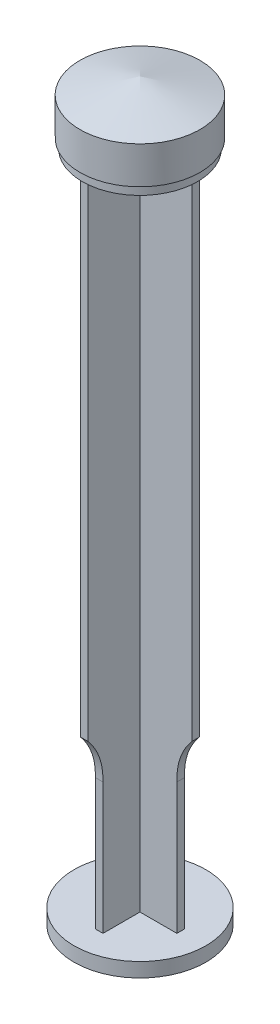
from build123d import *

# Parameters (mm, degrees)
SKETCH1_R               = 8.3
BOSS_EXTRUDE1_DEPTH     = 1.8
BOSS_EXTRUDE2_DEPTH     = 82.75
SKETCH3_R               = 7.25
BOSS_EXTRUDE3_DEPTH     = 1.15
SKETCH4_R               = 7.55
BOSS_EXTRUDE4_DEPTH     = 6.7
CHAMFER1_SIZE           = 2.023
CHAMFER1_SIZE2          = 7.549938784
CUT_EXTRUDE1_DEPTH      = 2
CUT_EXTRUDE1_DEPTH_BACK = 2
CUT_EXTRUDE2_DEPTH      = 2
CUT_EXTRUDE2_DEPTH_BACK = 2


with BuildPart() as part:
    # Sketch1 → Boss-Extrude1 (new body)
    with BuildSketch(Plane(origin=(0, 0, 0), x_dir=(1, 0, 0), z_dir=(0, 1, 0))):
        Circle(SKETCH1_R)
    extrude(amount=BOSS_EXTRUDE1_DEPTH)

    # Sketch2 → Boss-Extrude2 (add)
    with BuildSketch(Plane(origin=(0, 1.8, 0), x_dir=(1, 0, 0), z_dir=(0, 1, 0))):
        Polygon((-0.475, 0.475), (-0.475, 7), (0.475, 7), (0.475, 0.475), (7, 0.475), (7, -0.475), (0.475, -0.475), (0.475, -7), (-0.475, -7), (-0.475, -0.475), (-7, -0.475), (-7, 0.475), align=None)
    extrude(amount=BOSS_EXTRUDE2_DEPTH)

    # Sketch3 → Boss-Extrude3 (add)
    with BuildSketch(Plane(origin=(0, 84.55, 0), x_dir=(1, 0, 0), z_dir=(0, 1, 0))):
        Circle(SKETCH3_R)
    extrude(amount=BOSS_EXTRUDE3_DEPTH)

    # Sketch4 → Boss-Extrude4 (add)
    with BuildSketch(Plane(origin=(0, 85.7, 0), x_dir=(1, 0, 0), z_dir=(0, 1, 0))):
        Circle(SKETCH4_R)
    extrude(amount=BOSS_EXTRUDE4_DEPTH)

    # Chamfer1
    chamfer1_edges = [part.edges().sort_by_distance(p)[0] for p in [
        (-7.55, 92.4, 0),
    ]]
    chamfer1_side = [part.faces().sort_by_distance(p)[0] for p in [
        (-7.55, 89.05, 0),
    ]]
    chamfer(chamfer1_edges, length=CHAMFER1_SIZE, length2=CHAMFER1_SIZE2, reference=chamfer1_side[0])

    # Sketch7 → Cut-Extrude1 (cut, two sides: drawn at the far end of the back side and taken through both)
    with BuildSketch(Plane(origin=(0.475, 0, 0), x_dir=(0, 0, -1), z_dir=(1, 0, 0)).offset(-CUT_EXTRUDE1_DEPTH_BACK)):
        with BuildLine():
            Line((-7, 1.8), (-7, 23.65))
            add(Edge.make_bspline(
                [(-5.125, 18.3), (-5.059549187, 21.3387368), (-7, 23.65)],
                knots=[0, 0, 0, 1, 1, 1], degree=2))
            Line((-5.125, 18.3), (-5.125, 1.8))
            Line((-5.125, 1.8), (-7, 1.8))
        make_face()
        with BuildLine():
            Line((5.125, 1.8), (5.125, 18.3))
            add(Edge.make_bspline(
                [(5.125, 18.3), (5.059549187, 21.3387368), (7, 23.65)],
                knots=[0, 0, 0, 1, 1, 1], degree=2))
            Line((7, 23.65), (7, 1.8))
            Line((7, 1.8), (5.125, 1.8))
        make_face()
    extrude(amount=CUT_EXTRUDE1_DEPTH + CUT_EXTRUDE1_DEPTH_BACK, mode=Mode.SUBTRACT)

    # Sketch8 → Cut-Extrude2 (cut, two sides: drawn at the far end of the back side and taken through both)
    with BuildSketch(Plane.XY.offset(-CUT_EXTRUDE2_DEPTH_BACK)):
        with BuildLine():
            Line((-7, 1.8), (-7, 23.65))
            add(Edge.make_bspline(
                [(-5.125, 18.3), (-5.02840034, 21.345891772), (-7, 23.65)],
                knots=[0, 0, 0, 1, 1, 1], degree=2))
            Line((-5.125, 18.3), (-5.125, 1.8))
            Line((-5.125, 1.8), (-7, 1.8))
        make_face()
        with BuildLine():
            Line((7, 1.8), (5.125, 1.8))
            Line((5.125, 1.8), (5.125, 18.3))
            add(Edge.make_bspline(
                [(5.125, 18.3), (5.02840034, 21.345891772), (7, 23.65)],
                knots=[0, 0, 0, 1, 1, 1], degree=2))
            Line((7, 23.65), (7, 1.8))
        make_face()
    extrude(amount=CUT_EXTRUDE2_DEPTH + CUT_EXTRUDE2_DEPTH_BACK, mode=Mode.SUBTRACT)


solid = part.part
